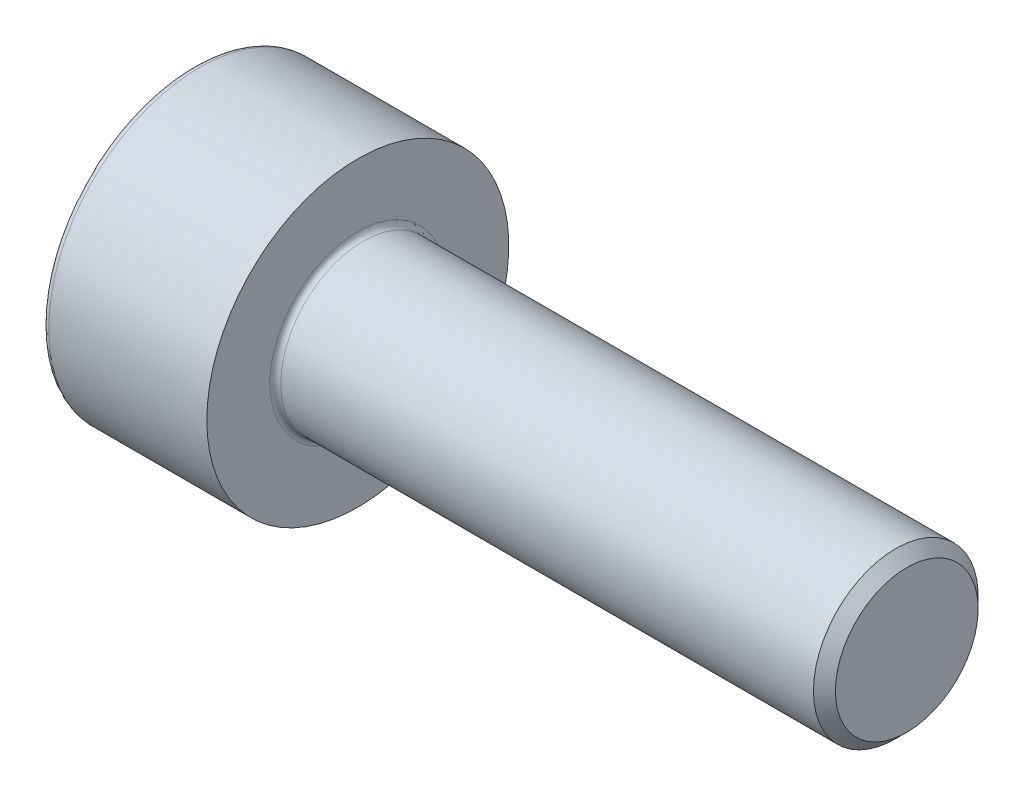
from build123d import *

# Parameters (mm, degrees)
FILLET1_R      = 0.1
FILLET2_R      = 0.12
CHAMFER1_SIZE  = 0.2
EXTRUDE1_DEPTH = 1


with BuildPart() as part:
    # Sketch1 → Revolve1 (revolve)
    with BuildSketch(Plane.XY, mode=Mode.PRIVATE) as revolve1_sk:
        Polygon((3, 1.5), (3, 0), (4.279914881, 0), (13, 0), (13, 1.5), align=None)
        Polygon((0, 2.75), (0, 0), (3, 0), (3, 1.5), (3, 2.75), align=None)
    revolve(revolve1_sk.sketch.rotate(Axis((0, 0, 0), (1, 0, 0)), 90), axis=Axis((0, 0, 0), (1, 0, 0)))

    # Fillet1
    fillet1_edges = [part.edges().sort_by_distance(p)[0] for p in [
        (3, 0, -1.5),
    ]]
    fillet(fillet1_edges, radius=FILLET1_R)

    # Fillet2
    fillet2_edges = [part.edges().sort_by_distance(p)[0] for p in [
        (0, 0, -2.75),
    ]]
    fillet(fillet2_edges, radius=FILLET2_R)

    # Chamfer1
    chamfer1_edges = [part.edges().sort_by_distance(p)[0] for p in [
        (13, 0, -1.5),
    ]]
    chamfer(chamfer1_edges, length=CHAMFER1_SIZE)

    # Sketch2 → Extrude1 (cut)
    with BuildSketch(Plane.ZY):
        Polygon((0, 1.443375673), (-1.25, 0.721687836), (-1.25, -0.721687836), (0, -1.443375673), (1.25, -0.721687836), (1.25, 0.721687836), align=None)
    extrude(amount=-EXTRUDE1_DEPTH, mode=Mode.SUBTRACT)


solid = part.part
